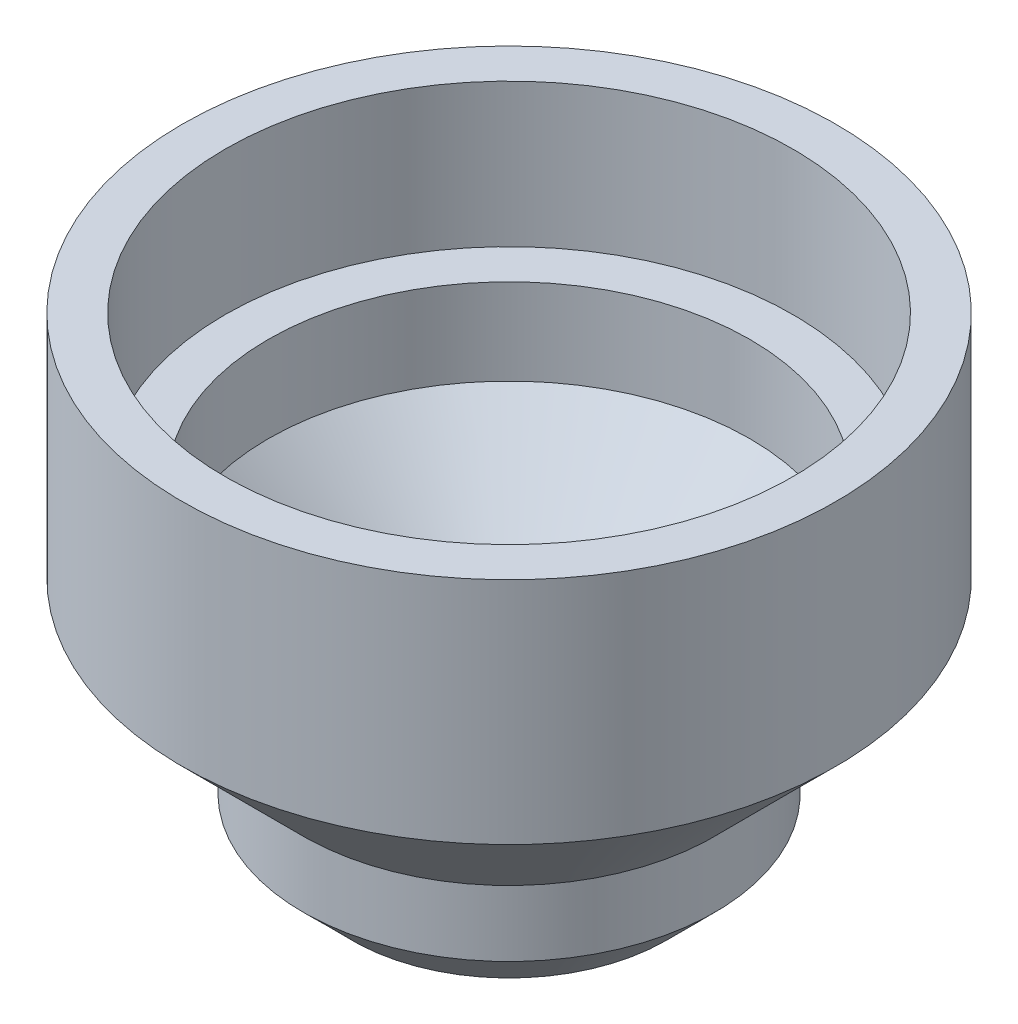
from build123d import *


with BuildPart() as part:
    # Sketch1 → Revolve1 (revolve)
    with BuildSketch(Plane.XY, mode=Mode.PRIVATE) as revolve1_sk:
        Polygon((5.480253608, -2.919746392), (5.480253608, -8.215318278), (7.180253608, -6.515318278), (7.180253608, -4.219746392), (11.4, 0), (11.4, 8), (9.9, 8), (9.9, 3), (8.4, 3), (8.4, 0), align=None)
    revolve(revolve1_sk.sketch.rotate(Axis((0, 51.27419464, 0), (0, -1, 0)), 180), axis=Axis((0, 51.27419464, 0), (0, -1, 0)))


solid = part.part
